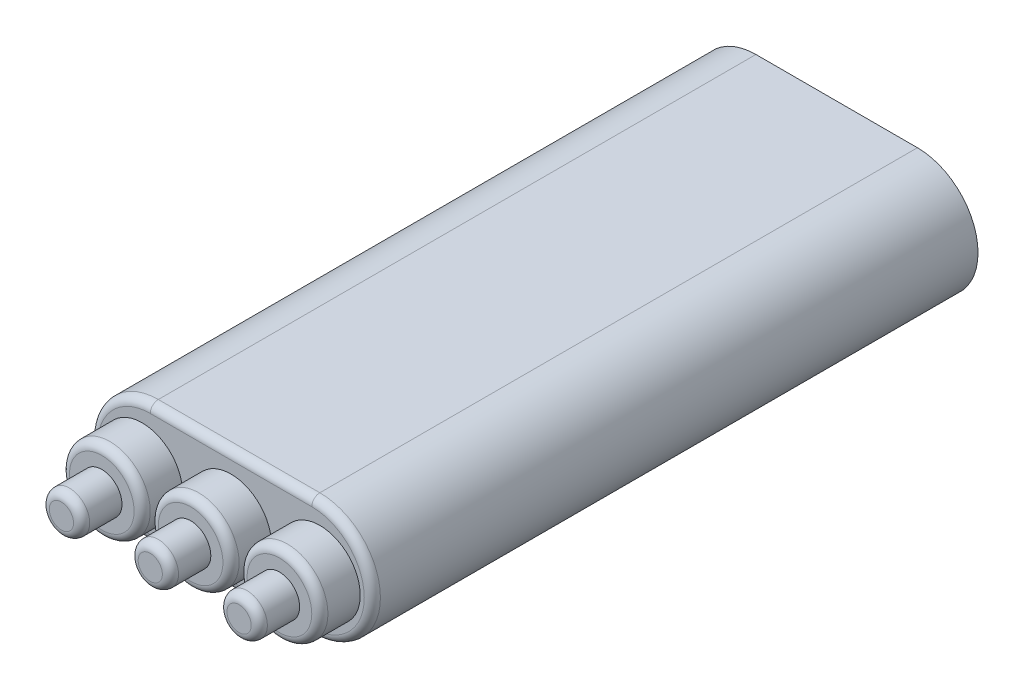
from build123d import *

# Parameters (mm, degrees)
EXTRUDE_1_DEPTH   = 15
SKETCH_2_R        = 1
EXTRUDE_2_DEPTH   = 1
EXTRUDE_2_2_DEPTH = 1
EXTRUDE_2_3_DEPTH = 1
SKETCH_4_R        = 0.5
EXTRUDE_3_DEPTH   = 1
EXTRUDE_3_2_DEPTH = 1
EXTRUDE_3_3_DEPTH = 1
FILLET_1_R        = 0.2
FILLET_2_R        = 0.2
FILLET_3_R        = 0.2
FILLET_4_R        = 0.2
FILLET_5_R        = 0.2
FILLET_6_R        = 0.2
FILLET_7_R        = 0.2


with BuildPart() as part:
    # Эскиз1 → Бобышка-Вытянуть1 (new body)
    with BuildSketch(Plane.XY):
        with BuildLine():
            Line((-2, 1.5), (2, 1.5))
            ThreePointArc((2, 1.5), (3.5, 0), (2, -1.5))
            Line((2, -1.5), (-2, -1.5))
            ThreePointArc((-2, -1.5), (-3.5, 0), (-2, 1.5))
        make_face()
    extrude(amount=EXTRUDE_1_DEPTH)

    # Скругление1
    fillet_1_edges = [part.edges().sort_by_distance(p)[0] for p in [
        (3.5, 0, 15),
        (0, 1.5, 15),
        (-3.5, 0, 15),
        (0, -1.5, 15),
    ]]
    fillet(fillet_1_edges, radius=FILLET_1_R)


with BuildPart() as body_2:
    # Эскиз2 → Бобышка-Вытянуть2 (new body)
    with BuildSketch(Plane.XY.offset(15)):
        with Locations((-2.2, 0)):
            Circle(SKETCH_2_R)
    extrude(amount=EXTRUDE_2_DEPTH)

    # Скругление2
    fillet_2_edges = [body_2.edges().sort_by_distance(p)[0] for p in [
        (-3.2, 0, 16),
    ]]
    fillet(fillet_2_edges, radius=FILLET_2_R)


with BuildPart() as body_3:
    # Эскиз2 → Extrude 2 2 (new body)
    with BuildSketch(Plane.XY.offset(15)):
        Circle(SKETCH_2_R)
    extrude(amount=EXTRUDE_2_2_DEPTH)

    # Скругление3
    fillet_3_edges = [body_3.edges().sort_by_distance(p)[0] for p in [
        (-1, 0, 16),
    ]]
    fillet(fillet_3_edges, radius=FILLET_3_R)


with BuildPart() as body_4:
    # Эскиз2 → Extrude 2 3 (new body)
    with BuildSketch(Plane.XY.offset(15)):
        with Locations((2.2, 0)):
            Circle(SKETCH_2_R)
    extrude(amount=EXTRUDE_2_3_DEPTH)

    # Скругление4
    fillet_4_edges = [body_4.edges().sort_by_distance(p)[0] for p in [
        (1.2, 0, 16),
    ]]
    fillet(fillet_4_edges, radius=FILLET_4_R)


with BuildPart() as body_5:
    # Эскиз4 → Бобышка-Вытянуть3 (new body)
    with BuildSketch(Plane.XY.offset(16)):
        Circle(SKETCH_4_R)
    extrude(amount=EXTRUDE_3_DEPTH)

    # Скругление6
    fillet_6_edges = [body_5.edges().sort_by_distance(p)[0] for p in [
        (-0.5, 0, 17),
    ]]
    fillet(fillet_6_edges, radius=FILLET_6_R)


with BuildPart() as body_6:
    # Эскиз4 → Extrude 3 2 (new body)
    with BuildSketch(Plane.XY.offset(16)):
        with Locations((-2.2, 0)):
            Circle(SKETCH_4_R)
    extrude(amount=EXTRUDE_3_2_DEPTH)

    # Скругление5
    fillet_5_edges = [body_6.edges().sort_by_distance(p)[0] for p in [
        (-2.7, 0, 17),
    ]]
    fillet(fillet_5_edges, radius=FILLET_5_R)


with BuildPart() as body_7:
    # Эскиз4 → Extrude 3 3 (new body)
    with BuildSketch(Plane.XY.offset(16)):
        with Locations((2.2, 0)):
            Circle(SKETCH_4_R)
    extrude(amount=EXTRUDE_3_3_DEPTH)

    # Скругление7
    fillet_7_edges = [body_7.edges().sort_by_distance(p)[0] for p in [
        (1.7, 0, 17),
    ]]
    fillet(fillet_7_edges, radius=FILLET_7_R)


solid = Compound([part.part, body_2.part, body_3.part, body_4.part, body_5.part, body_6.part, body_7.part])
